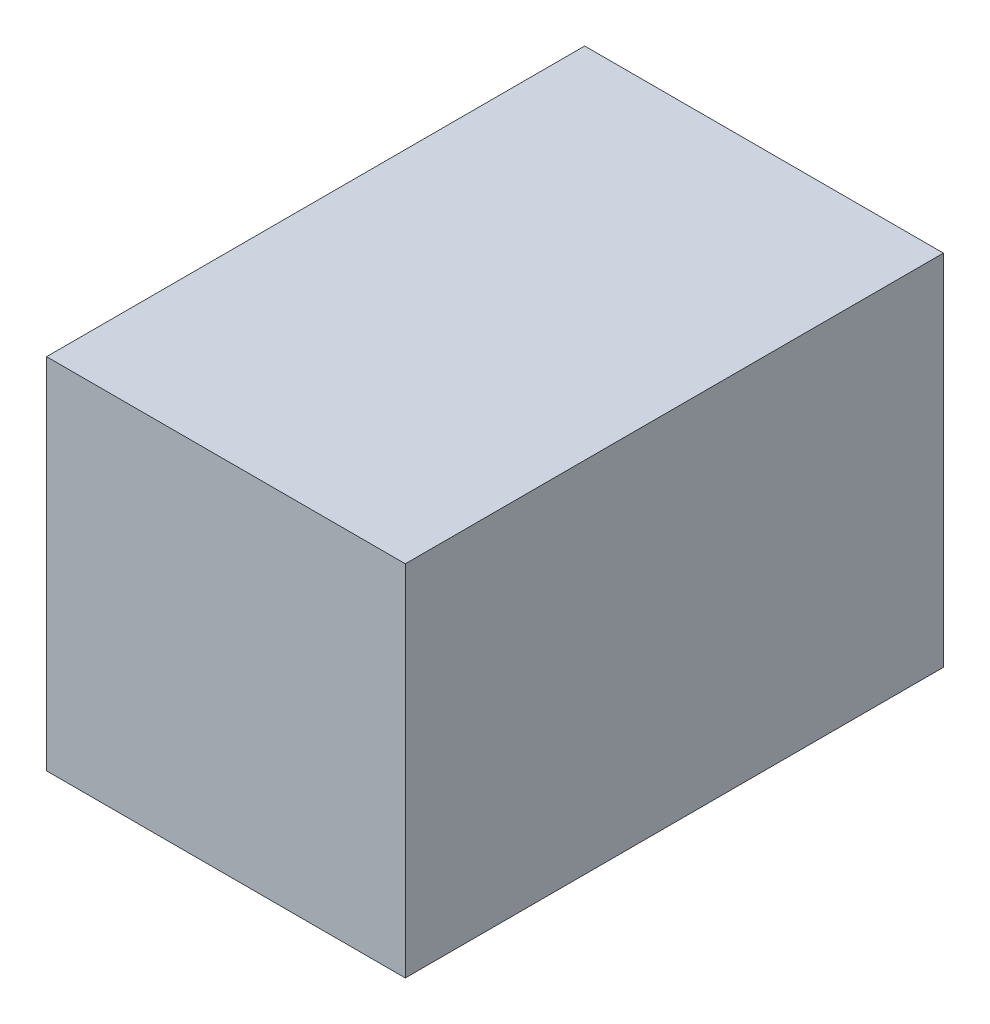
from build123d import *

# Parameters (mm, degrees)
BOSS_EXTRUDE1_START = 1.5875
SKETCH1_W           = 3.175
SKETCH1_H           = 3.175
BOSS_EXTRUDE1_DEPTH = 4.7625


with BuildPart() as part:
    # Sketch1 → Boss-Extrude1 (new body)
    with BuildSketch(Plane.XY.offset(20.11015).offset(BOSS_EXTRUDE1_START)):
        with Locations((0, 5.0927)):
            Rectangle(SKETCH1_W, SKETCH1_H)
    extrude(amount=BOSS_EXTRUDE1_DEPTH)


solid = part.part
